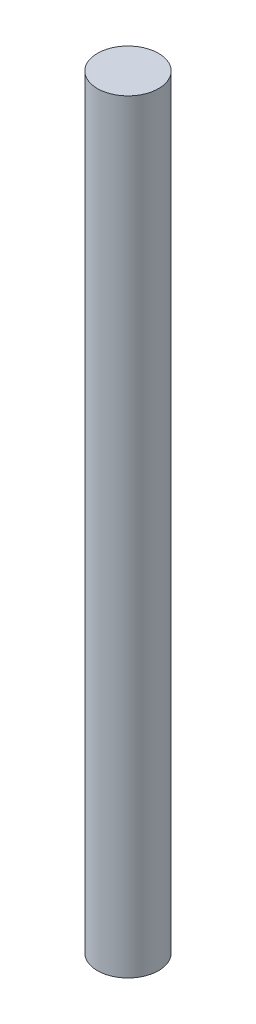
from build123d import *

# Parameters (mm, degrees)
SKETCH1_R           = 8
BOSS_EXTRUDE1_DEPTH = 200


with BuildPart() as part:
    # Sketch1 → Boss-Extrude1 (new body)
    with BuildSketch(Plane(origin=(0, 0, 0), x_dir=(1, 0, 0), z_dir=(0, 1, 0))):
        with Locations(Location((0, 0, 0), (0, 0, 270))):
            Circle(SKETCH1_R)
    extrude(amount=BOSS_EXTRUDE1_DEPTH)


solid = part.part
